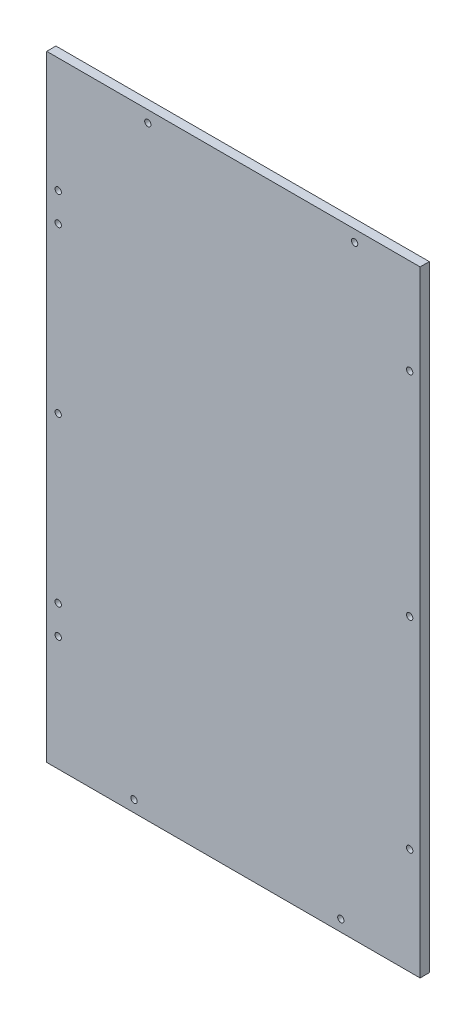
from build123d import *

# Parameters (mm, degrees)
SKETCH1_W           = 325.000000395
SKETCH1_H           = 536
SKETCH1_R           = 2.75
SKETCH1_R_2         = 2.749999922
SKETCH1_R_3         = 2.749999896
BOSS_EXTRUDE1_DEPTH = 8


with BuildPart() as part:
    # Sketch1 → Boss-Extrude1 (new body)
    with BuildSketch(Plane.XY):
        with Locations((-105.499999802, 0)):
            Rectangle(SKETCH1_W, SKETCH1_H)
        with Locations((0, 258)):
            Circle(SKETCH1_R, mode=Mode.SUBTRACT)
        with Locations((-180, 258)):
            Circle(SKETCH1_R, mode=Mode.SUBTRACT)
        with Locations((47.939987334, 0)):
            Circle(SKETCH1_R, mode=Mode.SUBTRACT)
        with Locations((47.939987334, 185.031928087)):
            Circle(SKETCH1_R, mode=Mode.SUBTRACT)
        with Locations((47.939987334, -175.453286577)):
            Circle(SKETCH1_R, mode=Mode.SUBTRACT)
        with Locations((-12.009451925, -258)):
            Circle(SKETCH1_R, mode=Mode.SUBTRACT)
        with Locations((-192.009451925, -258)):
            Circle(SKETCH1_R, mode=Mode.SUBTRACT)
        with Locations((-257.999921928, 0)):
            Circle(SKETCH1_R, mode=Mode.SUBTRACT)
        with Locations((-257.999921928, -167.990470003)):
            Circle(SKETCH1_R, mode=Mode.SUBTRACT)
        with Locations((-257.999921928, 168.009529997)):
            Circle(SKETCH1_R, mode=Mode.SUBTRACT)
        with Locations((-257.999921928, 143.009529997)):
            Circle(SKETCH1_R_2, mode=Mode.SUBTRACT)
        with Locations((-257.999921928, -142.990471748)):
            Circle(SKETCH1_R_3, mode=Mode.SUBTRACT)
    extrude(amount=BOSS_EXTRUDE1_DEPTH)


solid = part.part
